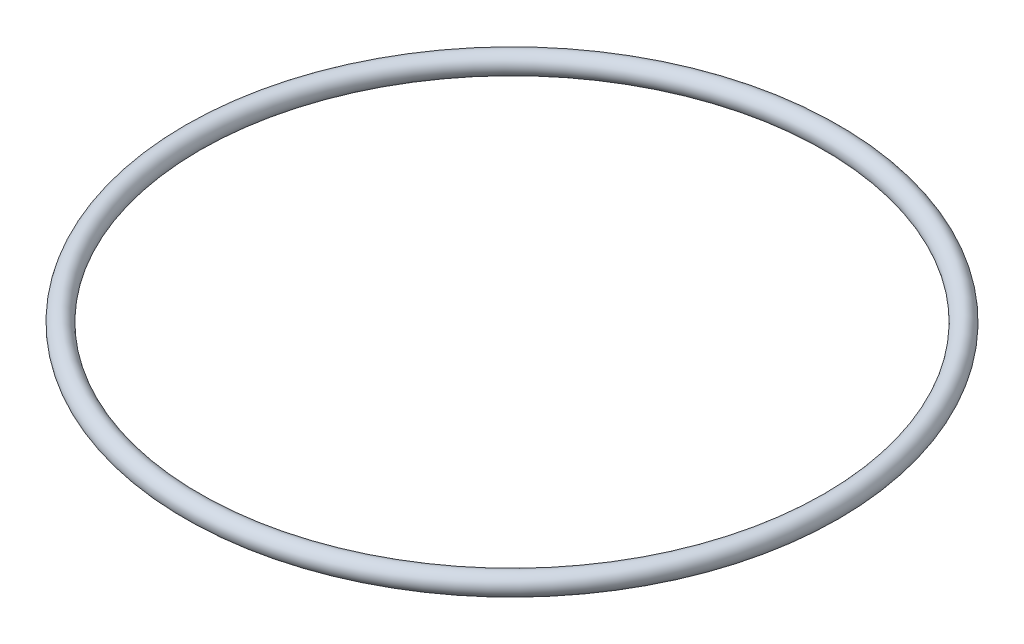
from build123d import *

# Parameters (mm, degrees)
SKETCH2_R = 1.5


with BuildPart() as part:
    # Sweep1: sweep along a path in Sketch1
    with BuildLine(Plane(origin=(0, 0, 0), x_dir=(1, 0, 0), z_dir=(0, 1, 0))) as sweep1_path:
        CenterArc((0, 0), 46.83, 0, 360)
    # Sketch2 → Sweep1 (sweep)
    with BuildSketch(Plane.XY):
        with Locations((-46.83, 0)):
            Circle(SKETCH2_R)
    sweep(path=sweep1_path.line)


solid = part.part
